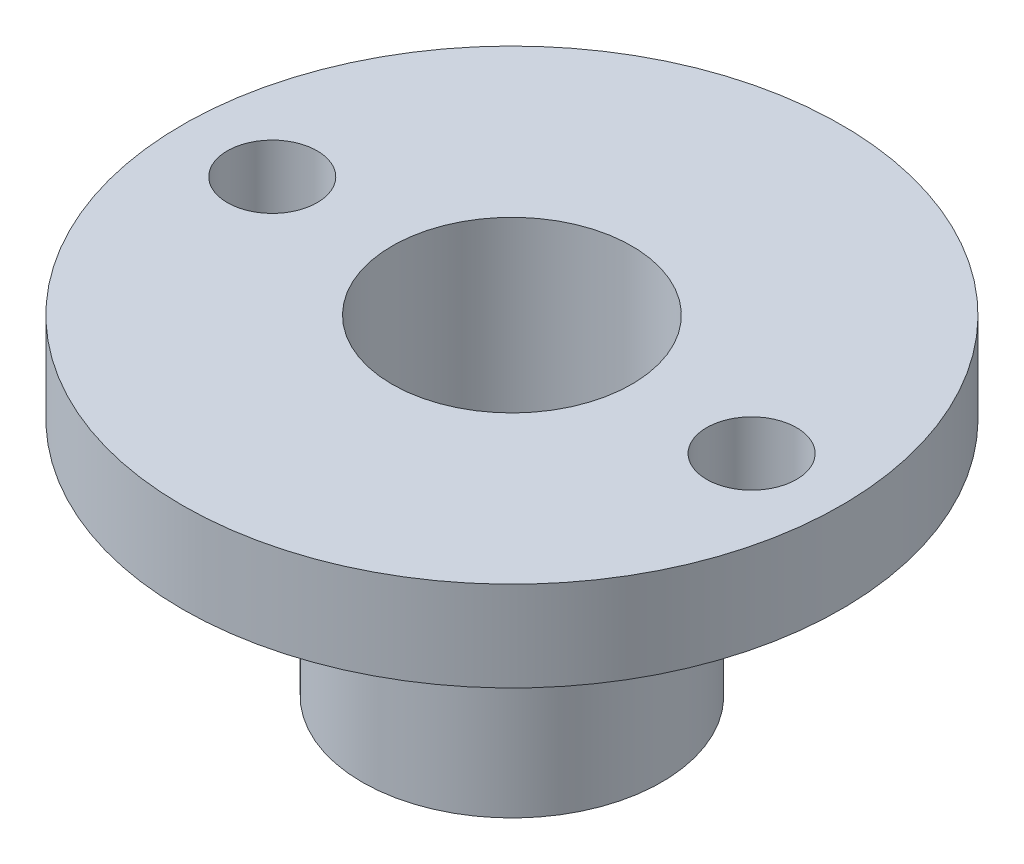
from build123d import *

# Parameters (mm, degrees)
SKICA1_R                 = 5
SKICA1_R_2               = 4
P_IDAT_VYSUNUT_M1_DEPTH  = 8
SKICA2_R                 = 11
SKICA2_R_2               = 4
P_IDAT_VYSUNUT_M2_DEPTH  = 3
SKICA3_R                 = 1.5
ODEBRAT_VYSUNUT_M3_DEPTH = 3


with BuildPart() as part:
    # Skica1 → Přidat vysunutím1 (new body)
    with BuildSketch(Plane(origin=(0, 0, 0), x_dir=(1, 0, 0), z_dir=(0, 1, 0))):
        with Locations(Location((0, 0, 0), (0, 0, 270))):
            Circle(SKICA1_R)
        with Locations(Location((0, 0, 0), (0, 0, 270))):
            Circle(SKICA1_R_2, mode=Mode.SUBTRACT)
    extrude(amount=P_IDAT_VYSUNUT_M1_DEPTH)

    # Skica2 → Přidat vysunutím2 (add)
    with BuildSketch(Plane(origin=(0, 8, 0), x_dir=(1, 0, 0), z_dir=(0, 1, 0))):
        with Locations(Location((0, 0, 0), (0, 0, 270))):
            Circle(SKICA2_R)
        with Locations(Location((0, 0, 0), (0, 0, 270))):
            Circle(SKICA2_R_2, mode=Mode.SUBTRACT)
    extrude(amount=P_IDAT_VYSUNUT_M2_DEPTH)

    # Skica3 → Odebrat vysunutím3 (cut)
    with BuildSketch(Plane(origin=(0, 11, 0), x_dir=(1, 0, 0), z_dir=(0, 1, 0))):
        with Locations(Location((8, 0, 0), (0, 0, 270))):
            Circle(SKICA3_R)
        with Locations(Location((-8, 0, 0), (0, 0, 270))):
            Circle(SKICA3_R)
    extrude(amount=-ODEBRAT_VYSUNUT_M3_DEPTH, mode=Mode.SUBTRACT)


solid = part.part
